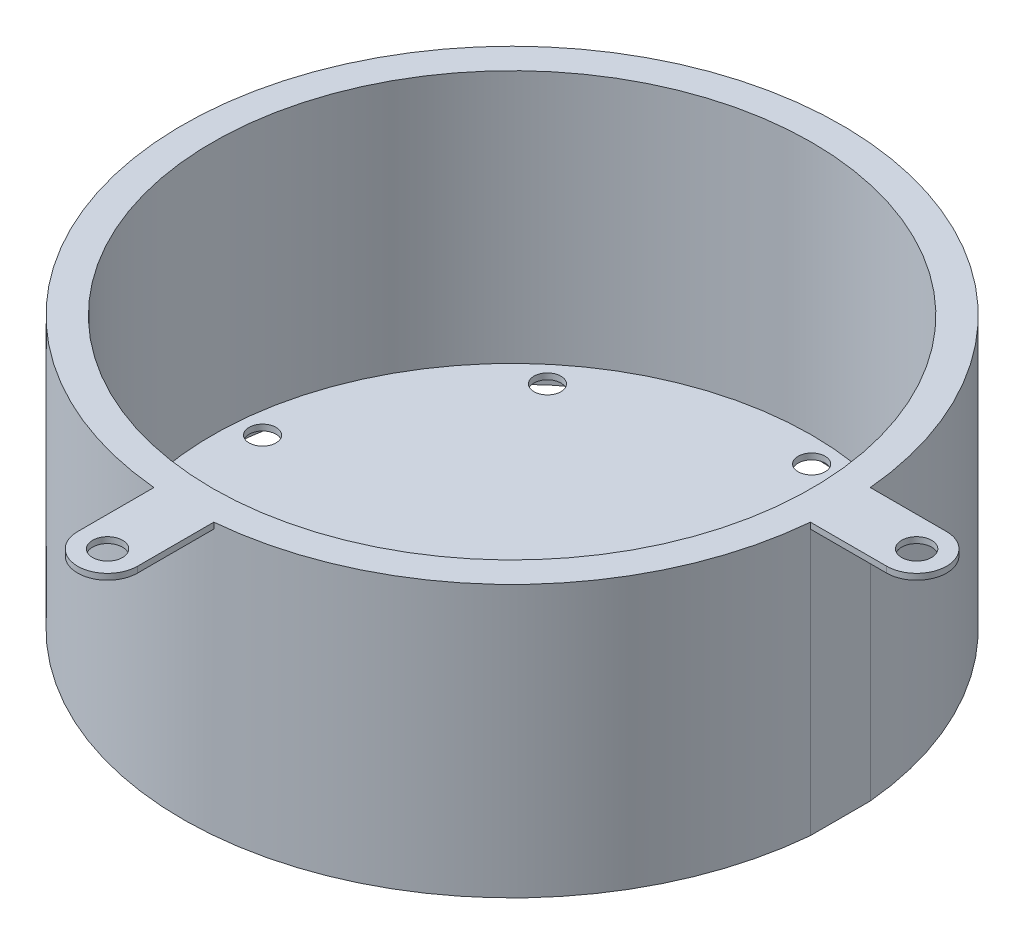
from build123d import *

# Parameters (mm, degrees)
EXTRUDE_1_DEPTH     = 45.3
SKETCH_2_R          = 50
CUT_EXTRUDE_1_DEPTH = 42.3
CUT_EXTRUDE_3_DEPTH = 44.3
CUT_EXTRUDE_START   = -2
SKETCH_5_R          = 50
CUT_EXTRUDE_4_DEPTH = 2
SKETCH_6_R          = 2.25
CUT_EXTRUDE_5_DEPTH = 101.777676099
SKETCH_7_R          = 2.5
CUT_EXTRUDE_6_DEPTH = 101.777676099
SKETCH_8_R          = 2.5
CUT_EXTRUDE_7_DEPTH = 102.211362998
EXTRUDE_2_DEPTH     = 1
SKETCH_10_R         = 2.5
CUT_EXTRUDE_8_DEPTH = 1


with BuildPart() as part:
    # 草图1 → 凸台-拉伸1 (new body)
    with BuildSketch(Plane(origin=(0, 0, 0), x_dir=(1, 0, 0), z_dir=(0, 1, 0))):
        with BuildLine():
            Line((54.772255751, 5), (67.5, 5))
            ThreePointArc((67.5, 5), (72.5, 0), (67.5, -5))
            Line((67.5, -5), (54.772255751, -5))
            ThreePointArc((54.772255751, -5), (-55, 0), (54.772255751, 5))
        make_face()
    extrude(amount=EXTRUDE_1_DEPTH)

    # 草图2 → 切除-拉伸1 (cut)
    with BuildSketch(Plane(origin=(0, 45.3, 0), x_dir=(1, 0, 0), z_dir=(0, 1, 0))):
        with Locations(Location((0, 0, 0), (0, 0, 270))):
            Circle(SKETCH_2_R)
    extrude(amount=-CUT_EXTRUDE_1_DEPTH, mode=Mode.SUBTRACT)

    # 草图4 → 切除-拉伸3 (cut)
    with BuildSketch(Plane.XZ):
        with BuildLine():
            Line((67.5, 5), (67.5, -5))
            ThreePointArc((67.5, -5), (72.5, 0), (67.5, 5))
        make_face()
        with BuildLine():
            ThreePointArc((72.5, 0), (71.035533906, 3.535533906), (67.5, 5))
            Line((67.5, 5), (67.5, -5))
            ThreePointArc((67.5, -5), (71.035533906, -3.535533906), (72.5, 0))
        make_face()
        with BuildLine():
            Line((67.5, -5), (67.5, 5))
            ThreePointArc((67.5, 5), (62.5, 0), (67.5, -5))
        make_face()
        with BuildLine():
            Line((67.5, 5), (54.772255751, 5))
            Line((54.772255751, 5), (54.772255751, -5))
            Line((54.772255751, -5), (67.5, -5))
            ThreePointArc((67.5, -5), (62.5, 0), (67.5, 5))
        make_face()
    extrude(amount=-CUT_EXTRUDE_3_DEPTH, mode=Mode.SUBTRACT)

    # 草图5 → 切除-拉伸4 (cut)
    with BuildSketch(Plane.XZ.offset(CUT_EXTRUDE_START)):
        with Locations(Location((0, 0, 0), (0, 0, 90))):
            Circle(SKETCH_5_R)
    extrude(amount=CUT_EXTRUDE_4_DEPTH, mode=Mode.SUBTRACT)

    # 草图6 → 切除-拉伸5 (cut, through all)
    with BuildSketch(Plane(origin=(0, 2, 0), x_dir=(-1, 0, 0), z_dir=(0, -1, 0))):
        with Locations(Location((-4.170920038, 45.810516544, 0), (0, 0, 90))):
            Circle(SKETCH_6_R)
        with Locations(Location((29.443641055, 35.342212741, 0), (0, 0, 90))):
            Circle(SKETCH_6_R)
        with Locations(Location((45.810516544, 4.170920038, 0), (0, 0, 90))):
            Circle(SKETCH_6_R)
        with Locations(Location((35.342212741, -29.443641055, 0), (0, 0, 90))):
            Circle(SKETCH_6_R)
        with Locations(Location((4.170920038, -45.810516544, 0), (0, 0, 90))):
            Circle(SKETCH_6_R)
        with Locations(Location((-29.443641055, -35.342212741, 0), (0, 0, 90))):
            Circle(SKETCH_6_R)
        with Locations(Location((-45.810516544, -4.170920038, 0), (0, 0, 90))):
            Circle(SKETCH_6_R)
        with Locations(Location((-35.342212741, 29.443641055, 0), (0, 0, 90))):
            Circle(SKETCH_6_R)
    extrude(amount=-CUT_EXTRUDE_5_DEPTH, mode=Mode.SUBTRACT)

    # 草图7 → 切除-拉伸6 (cut, through all)
    with BuildSketch(Plane.XZ.offset(-2)):
        with Locations(Location((0, 0, 0), (0, 0, 270))):
            Circle(SKETCH_7_R)
    extrude(amount=-CUT_EXTRUDE_6_DEPTH, mode=Mode.SUBTRACT)

    # 草图8 → 切除-拉伸7 (cut, through all)
    with BuildSketch(Plane.XZ.offset(-44.3)):
        with Locations(Location((67.5, 0, 0), (0, 0, 270))):
            Circle(SKETCH_8_R)
    extrude(amount=-CUT_EXTRUDE_7_DEPTH, mode=Mode.SUBTRACT)

    # 草图9 → 凸台-拉伸2 (add)
    with BuildSketch(Plane(origin=(0, 45.3, 0), x_dir=(1, 0, 0), z_dir=(0, 1, 0))):
        with BuildLine():
            Line((5, -67.5), (5, -54.718723613))
            Line((5, -54.718723613), (0, -55))
            Line((0, -55), (-5, -54.718723613))
            Line((-5, -54.718723613), (-5, -67.5))
            ThreePointArc((-5, -67.5), (0, -72.5), (5, -67.5))
        make_face()
    extrude(amount=-EXTRUDE_2_DEPTH)

    # 草图10 → 切除-拉伸8 (cut)
    with BuildSketch(Plane(origin=(0, 45.3, 0), x_dir=(1, 0, 0), z_dir=(0, 1, 0))):
        with Locations(Location((0, -67.5, 0), (0, 0, 270))):
            Circle(SKETCH_10_R)
    extrude(amount=-CUT_EXTRUDE_8_DEPTH, mode=Mode.SUBTRACT)


solid = part.part
